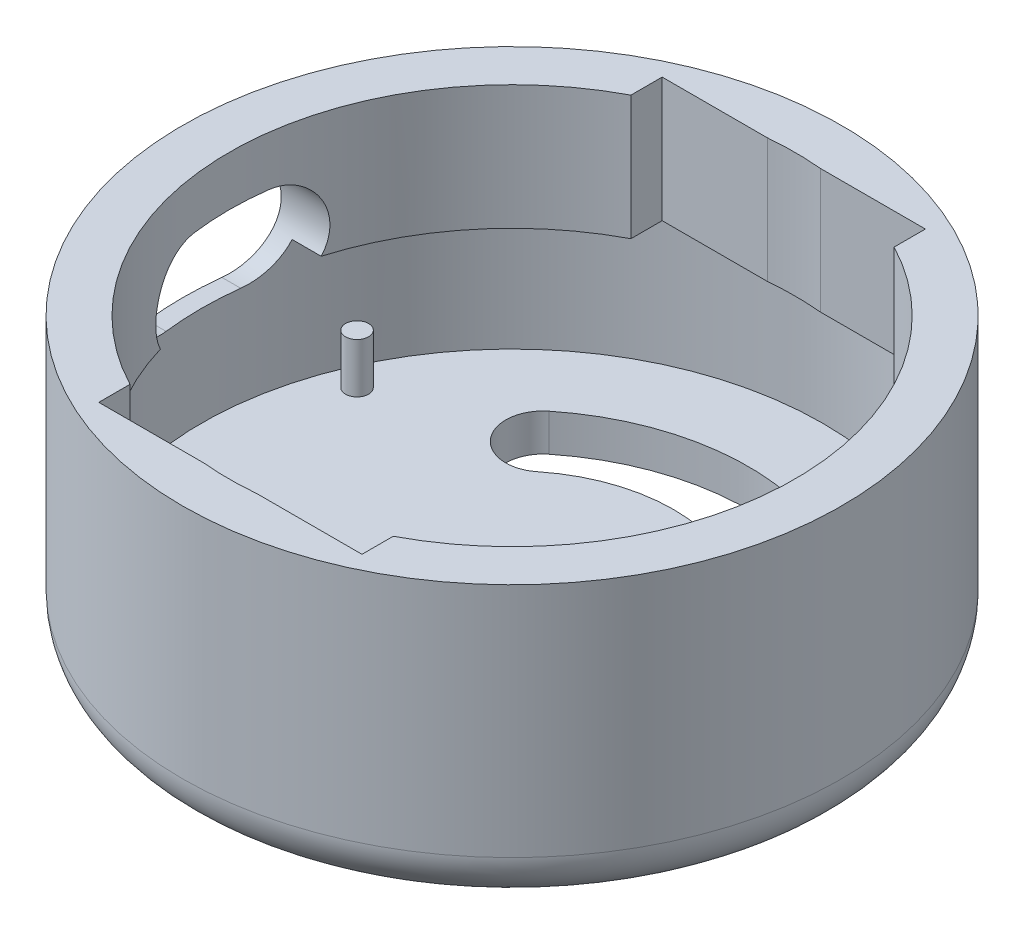
from build123d import *

# Parameters (mm, degrees)
SKETCH1_R           = 26.5
BOSS_EXTRUDE1_DEPTH = 3
BOSS_EXTRUDE2_START = 3
SKETCH1_3_R         = 26.5
SKETCH1_3_R_2       = 25
BOSS_EXTRUDE2_DEPTH = 10
CUT_EXTRUDE1_DEPTH  = 39.787884706
SKETCH3_R           = 26.5
SKETCH3_R_2         = 25
BOSS_EXTRUDE3_DEPTH = 10
SKETCH5_R           = 0.925
BOSS_EXTRUDE5_DEPTH = 4
FILLET1_R           = 4
CUT_EXTRUDE2_DEPTH  = 44


with BuildPart() as part:
    # Sketch1 → Boss-Extrude1 (new body)
    with BuildSketch(Plane(origin=(0, 0, 0), x_dir=(1, 0, 0), z_dir=(0, 1, 0))):
        with Locations(Location((0, 0, 0), (0, 0, 270))):
            Circle(SKETCH1_R)
    extrude(amount=BOSS_EXTRUDE1_DEPTH)

    # Sketch1<3> → Boss-Extrude2 (add)
    with BuildSketch(Plane(origin=(0, 0, 0), x_dir=(1, 0, 0), z_dir=(0, 1, 0)).offset(BOSS_EXTRUDE2_START)):
        with Locations(Location((0, 0, 0), (0, 0, 270))):
            Circle(SKETCH1_3_R)
        with Locations(Location((0, 0, 0), (0, 0, 270))):
            Circle(SKETCH1_3_R_2, mode=Mode.SUBTRACT)
    extrude(amount=BOSS_EXTRUDE2_DEPTH)

    # Sketch2 → Cut-Extrude1 (cut, through all)
    with BuildSketch(Plane(origin=(0, 3, 0), x_dir=(1, 0, 0), z_dir=(0, 1, 0))):
        with BuildLine():
            ThreePointArc((11.875, 14.831870246), (0, 19), (-11.875, 14.831870246))
            ThreePointArc((-11.875, 14.831870246), (-12.341874249, 10.614995997), (-8.125, 10.148121747))
            ThreePointArc((-8.125, 10.148121747), (0, 13), (8.125, 10.148121747))
            ThreePointArc((8.125, 10.148121747), (12.341874249, 10.614995997), (11.875, 14.831870246))
        make_face()
        with BuildLine():
            ThreePointArc((11.875, -14.831870246), (0, -19), (-11.875, -14.831870246))
            ThreePointArc((-11.875, -14.831870246), (-12.341874249, -10.614995997), (-8.125, -10.148121747))
            ThreePointArc((-8.125, -10.148121747), (0, -13), (8.125, -10.148121747))
            ThreePointArc((8.125, -10.148121747), (12.341874249, -10.614995997), (11.875, -14.831870246))
        make_face()
    extrude(amount=-CUT_EXTRUDE1_DEPTH, mode=Mode.SUBTRACT)

    # Sketch3 → Boss-Extrude3 (add)
    # profile 1 of 5: a face of its own
    with BuildSketch(Plane(origin=(0, 13, 0), x_dir=(1, 0, 0), z_dir=(0, 1, 0))):
        with Locations(Location((0, 0, 0), (0, 0, 270))):
            Circle(SKETCH3_R)
        with Locations(Location((0, 0, 0), (0, 0, 115.041695193))):
            Circle(SKETCH3_R_2, mode=Mode.SUBTRACT)
    # profile 2 of 5: a face of its own
    with BuildSketch(Plane(origin=(0, 13, 0), x_dir=(1, 0, 0), z_dir=(0, 1, 0))):
        with BuildLine():
            ThreePointArc((-10.581942166, 22.65), (-25, 0), (-10.581942166, -22.65))
            Line((-10.581942166, -22.65), (-10.581942166, -20.139140995))
            ThreePointArc((-10.581942166, -20.139140995), (-22.75, 0), (-10.581942166, 20.139140995))
            Line((-10.581942166, 20.139140995), (-10.581942166, 22.65))
        make_face()
    # profile 3 of 5: a face of its own
    with BuildSketch(Plane(origin=(0, 13, 0), x_dir=(1, 0, 0), z_dir=(0, 1, 0))):
        with BuildLine():
            ThreePointArc((10.581942166, 22.65), (0, 25), (-10.581942166, 22.65))
            Line((-10.581942166, 22.65), (-2.130727575, 22.65))
            ThreePointArc((-2.130727575, 22.65), (0, 22.75), (2.130727575, 22.65))
            Line((2.130727575, 22.65), (10.581942166, 22.65))
        make_face()
    # profile 4 of 5: a face of its own
    with BuildSketch(Plane(origin=(0, 13, 0), x_dir=(1, 0, 0), z_dir=(0, 1, 0))):
        with BuildLine():
            Line((10.581942166, -20.139140995), (10.581942166, -22.65))
            ThreePointArc((10.581942166, -22.65), (21.089672285, -13.424817426), (25, 0))
            ThreePointArc((25, 0), (21.089672285, 13.424817426), (10.581942166, 22.65))
            Line((10.581942166, 22.65), (10.581942166, 20.139140995))
            ThreePointArc((10.581942166, 20.139140995), (19.471796069, 11.7648484), (22.75, 0))
            ThreePointArc((22.75, 0), (19.471796069, -11.7648484), (10.581942166, -20.139140995))
        make_face()
    # profile 5 of 5: a face of its own
    with BuildSketch(Plane(origin=(0, 13, 0), x_dir=(1, 0, 0), z_dir=(0, 1, 0))):
        with BuildLine():
            Line((-2.130727575, -22.65), (-10.581942166, -22.65))
            ThreePointArc((-10.581942166, -22.65), (0, -25), (10.581942166, -22.65))
            Line((10.581942166, -22.65), (2.130727575, -22.65))
            ThreePointArc((2.130727575, -22.65), (0, -22.75), (-2.130727575, -22.65))
        make_face()
    extrude(amount=BOSS_EXTRUDE3_DEPTH)

    # Sketch5 → Boss-Extrude5 (add)
    with BuildSketch(Plane(origin=(0, 3, -3), x_dir=(1, 0, 0), z_dir=(0, -1, 0))):
        with Locations(Location((-21.225, 11.76, 0), (0, 0, 90))):
            Circle(SKETCH5_R)
        with Locations(Location((21.225, 11.76, 0), (0, 0, 90))):
            Circle(SKETCH5_R)
        with Locations(Location((-21.225, -5.76, 0), (0, 0, 90))):
            Circle(SKETCH5_R)
        with Locations(Location((21.225, -5.76, 0), (0, 0, 90))):
            Circle(SKETCH5_R)
    extrude(amount=-BOSS_EXTRUDE5_DEPTH)

    # Fillet1
    fillet1_edges = [part.edges().sort_by_distance(p)[0] for p in [
        (0, 0, -26.5),
    ]]
    fillet(fillet1_edges, radius=FILLET1_R)

    # Sketch6 → Cut-Extrude2 (cut)
    with BuildSketch(Plane(origin=(0, 0, 0), x_dir=(0, 0, -1), z_dir=(1, 0, 0))):
        with BuildLine():
            Line((-3, 19), (3, 19))
            ThreePointArc((3, 19), (7, 15), (3, 11))
            Line((3, 11), (-3, 11))
            ThreePointArc((-3, 11), (-7, 15), (-3, 19))
        make_face()
    extrude(amount=-CUT_EXTRUDE2_DEPTH, mode=Mode.SUBTRACT)


solid = part.part
